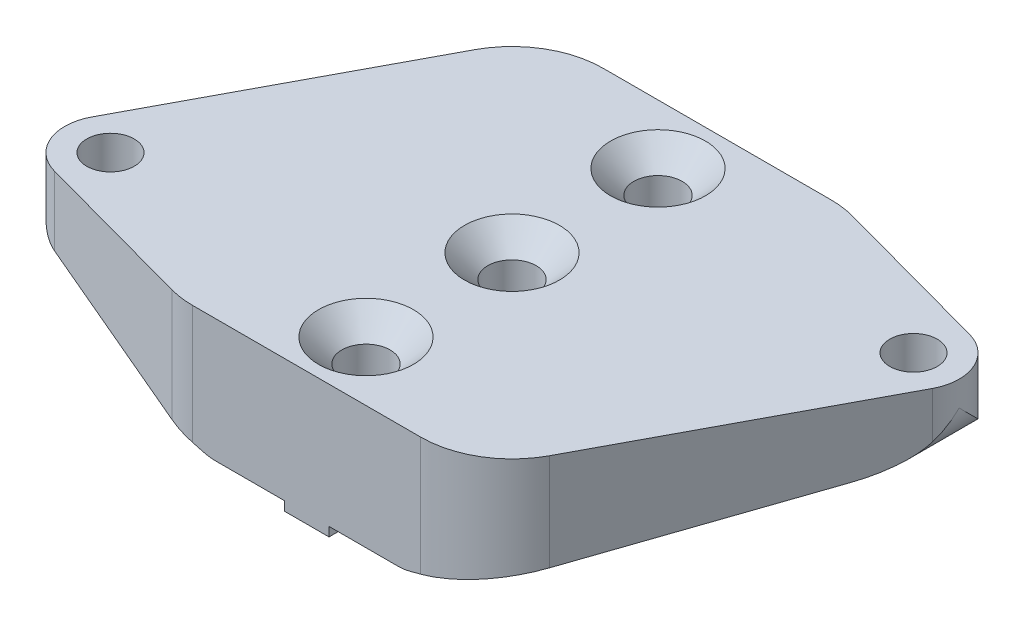
from build123d import *

# Parameters (mm, degrees)
SKETCH1_R                                       = 2.6
SKETCH1_R_2                                     = 6.25
SKETCH1_W                                       = 4.9
SKETCH1_H                                       = 45
BOSS_EXTRUDE1_DEPTH                             = 13.5
SKETCH1_3_R                                     = 6.25
BOSS_EXTRUDE2_DEPTH                             = 0.6
BOSS_EXTRUDE3_START                             = -13.5
SKETCH1_4_W                                     = 4.9
SKETCH1_4_H                                     = 45
BOSS_EXTRUDE3_DEPTH                             = 1
CSK_FOR_M5_FLAT_HEAD_MACHINE_SCREW2_D           = 5.3
CSK_FOR_M5_FLAT_HEAD_MACHINE_SCREW2_CSINK_D     = 10.4
CSK_FOR_M5_FLAT_HEAD_MACHINE_SCREW2_CSINK_ANGLE = 90
CUT_EXTRUDE1_DEPTH                              = 46.263119645


with BuildPart() as part:
    # Sketch1 → Boss-Extrude1 (new body)
    # profile 1 of 3: a face of its own
    with BuildSketch(Plane(origin=(0, 0, 0), x_dir=(1, 0, 0), z_dir=(0, 1, 0))):
        with BuildLine():
            Line((-2.45, 22.5), (-12.5, 22.5))
            ThreePointArc((-12.5, 22.5), (-17.644957554, 21.074929257), (-21.323529412, 17.205882353))
            Line((-21.323529412, 17.205882353), (-35.911764706, -10.147058824))
            ThreePointArc((-35.911764706, -10.147058824), (-36.091023102, -14.480531969), (-32.815789474, -17.323763889))
            Line((-32.815789474, -17.323763889), (-15.131578947, -22.147527779))
            ThreePointArc((-15.131578947, -22.147527779), (-13.827539493, -22.411490246), (-12.5, -22.5))
            Line((-12.5, -22.5), (-2.45, -22.5))
            Line((-2.45, -22.5), (-2.45, 22.5))
        make_face()
        with Locations(Location((-31.5, -12.5, 0), (0, 0, 270))):
            Circle(SKETCH1_R, mode=Mode.SUBTRACT)
        with Locations(Location((-12.5, -12.5, 0), (0, 0, 270))):
            Circle(SKETCH1_R_2, mode=Mode.SUBTRACT)
        with Locations(Location((-12.5, 12.5, 0), (0, 0, 270))):
            Circle(SKETCH1_R_2, mode=Mode.SUBTRACT)
    # profile 2 of 3: a face of its own
    with BuildSketch(Plane(origin=(0, 0, 0), x_dir=(1, 0, 0), z_dir=(0, 1, 0))):
        Rectangle(SKETCH1_W, SKETCH1_H)
    # profile 3 of 3: a face of its own
    with BuildSketch(Plane(origin=(0, 0, 0), x_dir=(1, 0, 0), z_dir=(0, 1, 0))):
        with BuildLine():
            Line((12.5, 22.5), (2.45, 22.5))
            Line((2.45, 22.5), (2.45, -22.5))
            Line((2.45, -22.5), (12.5, -22.5))
            ThreePointArc((12.5, -22.5), (17.644957554, -21.074929257), (21.323529412, -17.205882353))
            Line((21.323529412, -17.205882353), (35.911764706, 10.147058824))
            ThreePointArc((35.911764706, 10.147058824), (36.091023102, 14.480531969), (32.815789474, 17.323763889))
            Line((32.815789474, 17.323763889), (15.131578947, 22.147527779))
            ThreePointArc((15.131578947, 22.147527779), (13.827539493, 22.411490246), (12.5, 22.5))
        make_face()
        with Locations(Location((12.5, -12.5, 0), (0, 0, 270))):
            Circle(SKETCH1_R_2, mode=Mode.SUBTRACT)
        with Locations(Location((12.5, 12.5, 0), (0, 0, 270))):
            Circle(SKETCH1_R_2, mode=Mode.SUBTRACT)
        with Locations(Location((31.5, 12.5, 0), (0, 0, 270))):
            Circle(SKETCH1_R, mode=Mode.SUBTRACT)
    extrude(amount=-BOSS_EXTRUDE1_DEPTH)

    # Sketch1<3> → Boss-Extrude2 (add)
    with BuildSketch(Plane(origin=(0, 0, 0), x_dir=(1, 0, 0), z_dir=(0, 1, 0))):
        with Locations(Location((-12.5, 12.5, 0), (0, 0, 270))):
            Circle(SKETCH1_3_R)
        with Locations(Location((12.5, 12.5, 0), (0, 0, 270))):
            Circle(SKETCH1_3_R)
        with Locations(Location((12.5, -12.5, 0), (0, 0, 270))):
            Circle(SKETCH1_3_R)
        with Locations(Location((-12.5, -12.5, 0), (0, 0, 270))):
            Circle(SKETCH1_3_R)
    extrude(amount=-BOSS_EXTRUDE2_DEPTH)

    # Sketch1<4> → Boss-Extrude3 (add)
    with BuildSketch(Plane(origin=(0, 0, 0), x_dir=(1, 0, 0), z_dir=(0, 1, 0)).offset(BOSS_EXTRUDE3_START)):
        Rectangle(SKETCH1_4_W, SKETCH1_4_H)
    extrude(amount=-BOSS_EXTRUDE3_DEPTH)

    # CSK for M5 Flat Head Machine Screw2 (through all)
    with Locations(Plane(origin=(0, 0, 0), x_dir=(1, 0, 0), z_dir=(0, 1, 0))):
        with Locations((0, 16), (0, 0), (0, -16)):
            CounterSinkHole(CSK_FOR_M5_FLAT_HEAD_MACHINE_SCREW2_D / 2, CSK_FOR_M5_FLAT_HEAD_MACHINE_SCREW2_CSINK_D / 2, counter_sink_angle=CSK_FOR_M5_FLAT_HEAD_MACHINE_SCREW2_CSINK_ANGLE)

    # Sketch8 → Cut-Extrude1 (cut, symmetric)
    with BuildSketch(Plane.XY):
        with BuildLine():
            ThreePointArc((32.794095226, -7.568721494), (35.466766701, -5.782899508), (36.5, -2.739092363))
            Line((36.5, -2.739092363), (36.5, -13.5))
            Line((36.5, -13.5), (10, -13.5))
            ThreePointArc((10, -13.5), (10.652630961, -13.457224307), (11.294095226, -13.329629131))
            Line((11.294095226, -13.329629131), (32.794095226, -7.568721494))
        make_face()
    cut_extrude1 = extrude(amount=CUT_EXTRUDE1_DEPTH, both=True, mode=Mode.SUBTRACT)

    # Mirror1: Cut-Extrude1 across plane
    add(cut_extrude1.mirror(Plane(origin=(0, 0, 0), x_dir=(0, 0, 1), z_dir=(1, 0, 0))), mode=Mode.SUBTRACT)


solid = part.part
